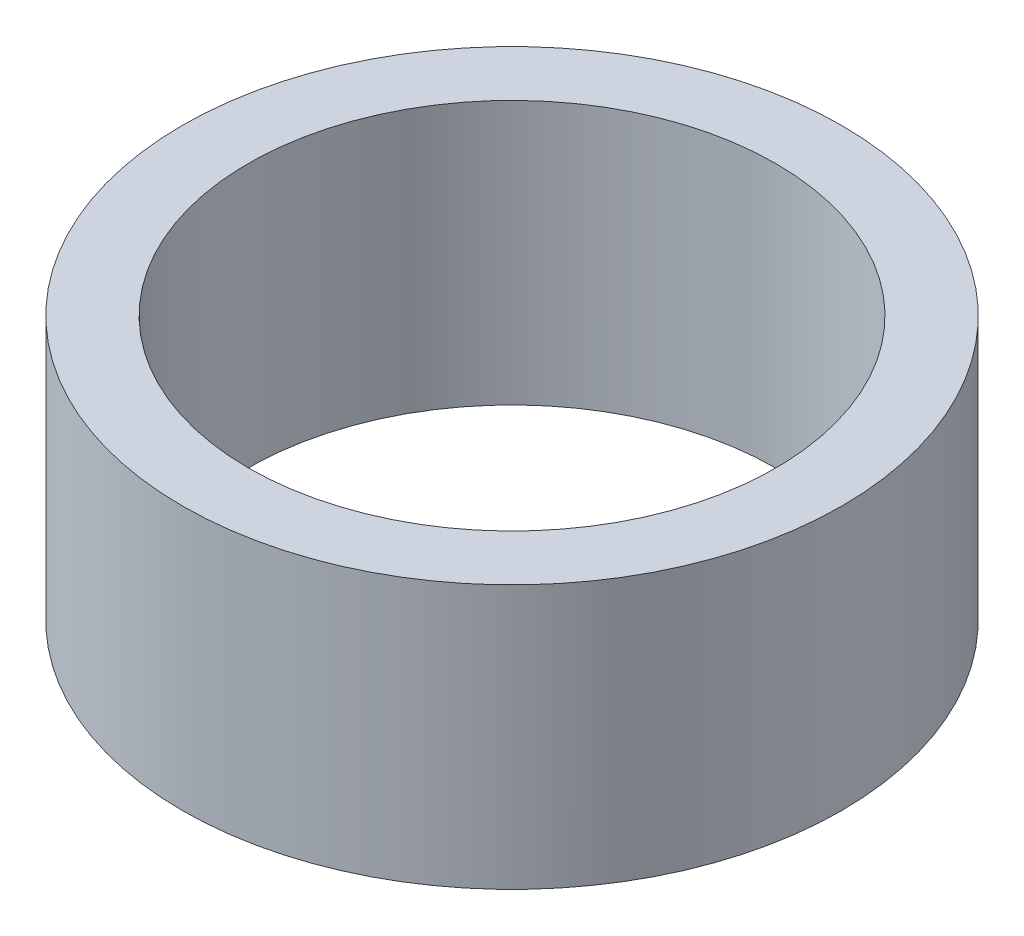
from build123d import *

# Parameters (mm, degrees)
ESQUISSE1_R          = 5
ESQUISSE1_R_2        = 4
BASE_EXTRUSION_DEPTH = 4


with BuildPart() as part:
    # Esquisse1 → Base-Extrusion (new body)
    with BuildSketch(Plane(origin=(0.07708928, 595.693666481, -0.11724482), x_dir=(-0.9999999916264037, 0.00012941094413665422, 0), z_dir=(0.0001294109416300697, 0.9999999722572189, -0.00019682065317602586))):
        with Locations(Location((-2143.706121951, 669.110625297, 0), (0, 0, 269.999998541))):
            Circle(ESQUISSE1_R)
        with Locations(Location((-2143.706121951, 669.110625297, 0), (0, 0, 269.999998541))):
            Circle(ESQUISSE1_R_2, mode=Mode.SUBTRACT)
    extrude(amount=-BASE_EXTRUSION_DEPTH)


solid = part.part
